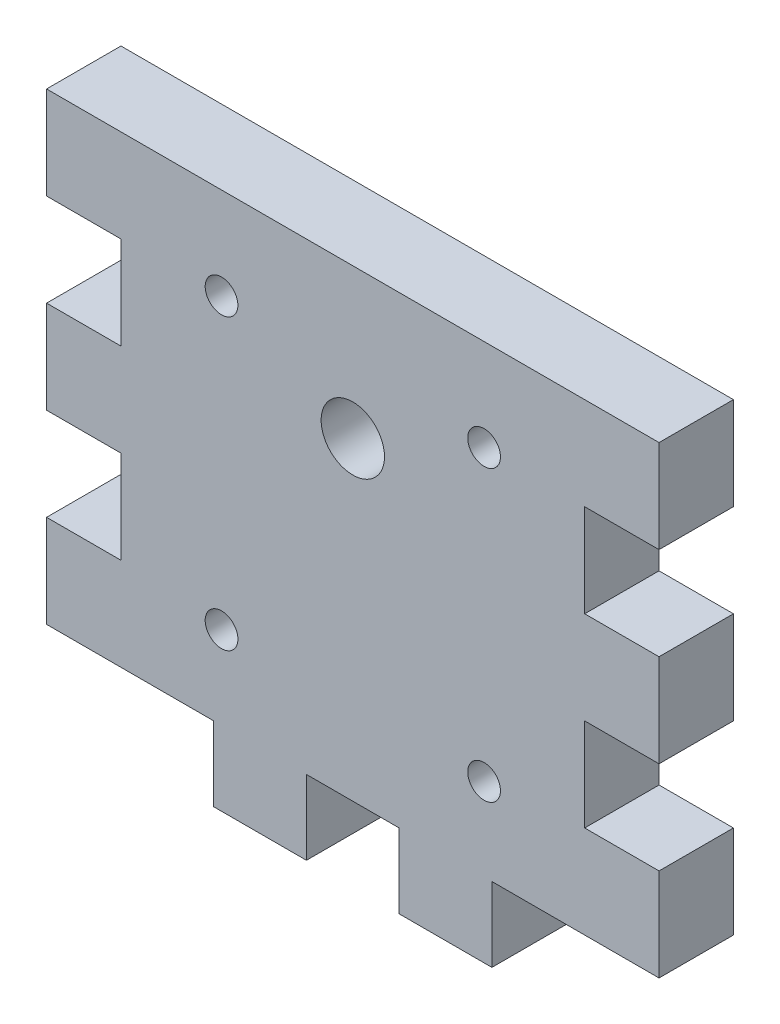
from build123d import *

# Parameters (mm, degrees)
SKETCH1_R           = 1.397
SKETCH1_R_2         = 2.704093878
BOSS_EXTRUDE1_DEPTH = 6.35


with BuildPart() as part:
    # Sketch1 → Boss-Extrude1 (new body)
    with BuildSketch(Plane.XY):
        Polygon((34.222577161, -16.34309441), (34.222577161, -24.260672631), (40.572577161, -24.260672631), (40.572577161, -32.178250852), (34.222577161, -32.178250852), (26.30499894, -32.178250852), (26.30499894, -38.528250852), (18.387420719, -38.528250852), (18.387420719, -32.178250852), (10.469842498, -32.178250852), (10.469842498, -38.528250852), (2.552264276, -38.528250852), (2.552264276, -32.178250852), (-5.365313945, -32.178250852), (-11.715313945, -32.178250852), (-11.715313945, -24.260672631), (-5.365313945, -24.260672631), (-5.365313945, -16.34309441), (-11.715313945, -16.34309441), (-11.715313945, -8.425516188), (-5.365313945, -8.425516188), (-5.365313945, -0.507937967), (-11.715313945, -0.507937967), (-11.715313945, 7.409640254), (40.572577161, 7.409640254), (40.572577161, -0.507937967), (34.222577161, -0.507937967), (34.222577161, -8.425516188), (40.572577161, -8.425516188), (40.572577161, -16.34309441), align=None)
        with Locations((3.220865479, -0.422913296)):
            Circle(SKETCH1_R, mode=Mode.SUBTRACT)
        with Locations((25.636397737, -0.422913296)):
            Circle(SKETCH1_R, mode=Mode.SUBTRACT)
        with Locations((25.636397737, -25.106684096)):
            Circle(SKETCH1_R, mode=Mode.SUBTRACT)
        with Locations((3.220865479, -25.106684096)):
            Circle(SKETCH1_R, mode=Mode.SUBTRACT)
        with Locations((14.428631608, -5.359667456)):
            Circle(SKETCH1_R_2, mode=Mode.SUBTRACT)
    extrude(amount=BOSS_EXTRUDE1_DEPTH)


solid = part.part
